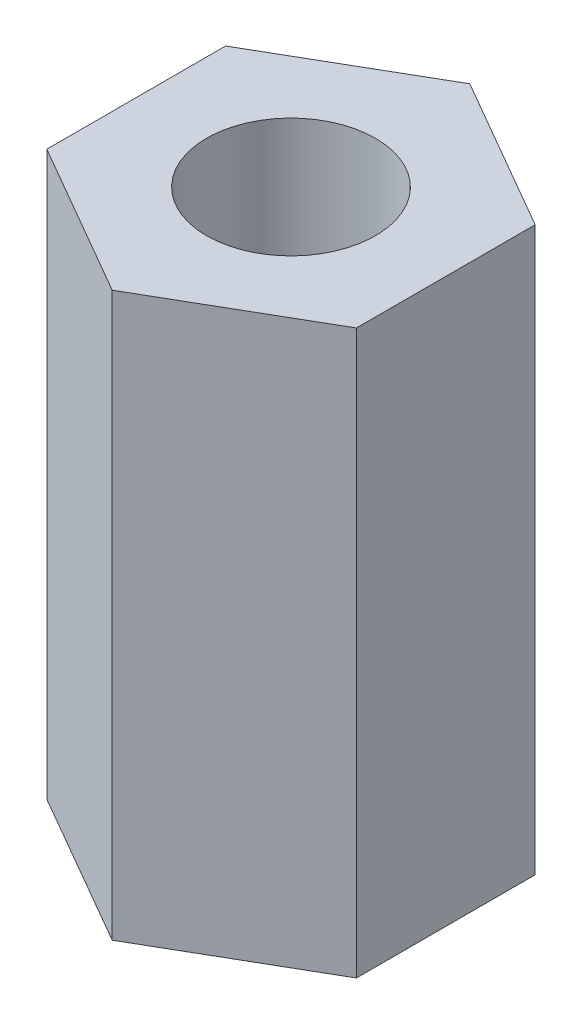
from build123d import *

# Parameters (mm, degrees)
SKETCH_1_R      = 1.5
EXTRUDE_1_DEPTH = 10


with BuildPart() as part:
    # 草图1 → 凸台-拉伸1 (new body)
    with BuildSketch(Plane(origin=(0, 0, 0), x_dir=(1, 0, 0), z_dir=(0, 1, 0))):
        Polygon((0, 3.175426481), (-2.75, 1.58771324), (-2.75, -1.58771324), (0, -3.175426481), (2.75, -1.58771324), (2.75, 1.58771324), align=None)
        with Locations(Location((0, 0, 0), (0, 0, 270))):
            Circle(SKETCH_1_R, mode=Mode.SUBTRACT)
    extrude(amount=EXTRUDE_1_DEPTH)


solid = part.part
